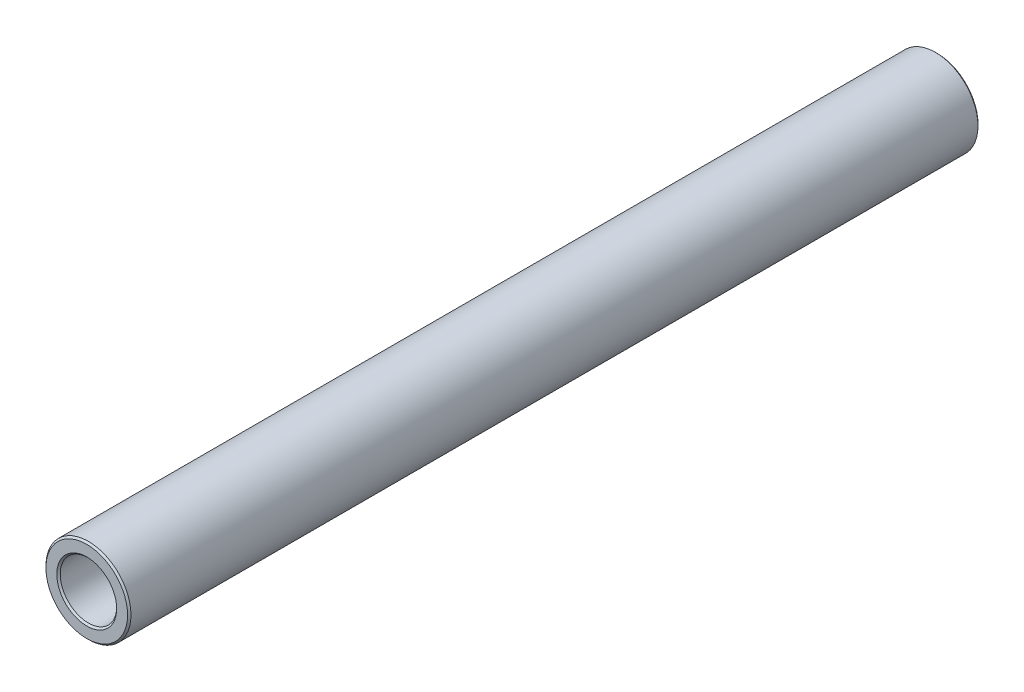
from build123d import *

# Parameters (mm, degrees)
SKETCH1_R           = 3.175
SKETCH1_R_2         = 2.1082
BOSS_EXTRUDE1_DEPTH = 63.5
CHAMFER1_SIZE       = 0.127


with BuildPart() as part:
    # Sketch1 → Boss-Extrude1 (new body)
    with BuildSketch(Plane.XY):
        Circle(SKETCH1_R)
        Circle(SKETCH1_R_2, mode=Mode.SUBTRACT)
    extrude(amount=BOSS_EXTRUDE1_DEPTH)

    # Chamfer1
    chamfer1_edges = [part.edges().sort_by_distance(p)[0] for p in [
        (-3.175, 0, 0),
        (-3.175, 0, 63.5),
        (-2.1082, 0, 0),
        (-2.1082, 0, 63.5),
    ]]
    chamfer(chamfer1_edges, length=CHAMFER1_SIZE)


solid = part.part
